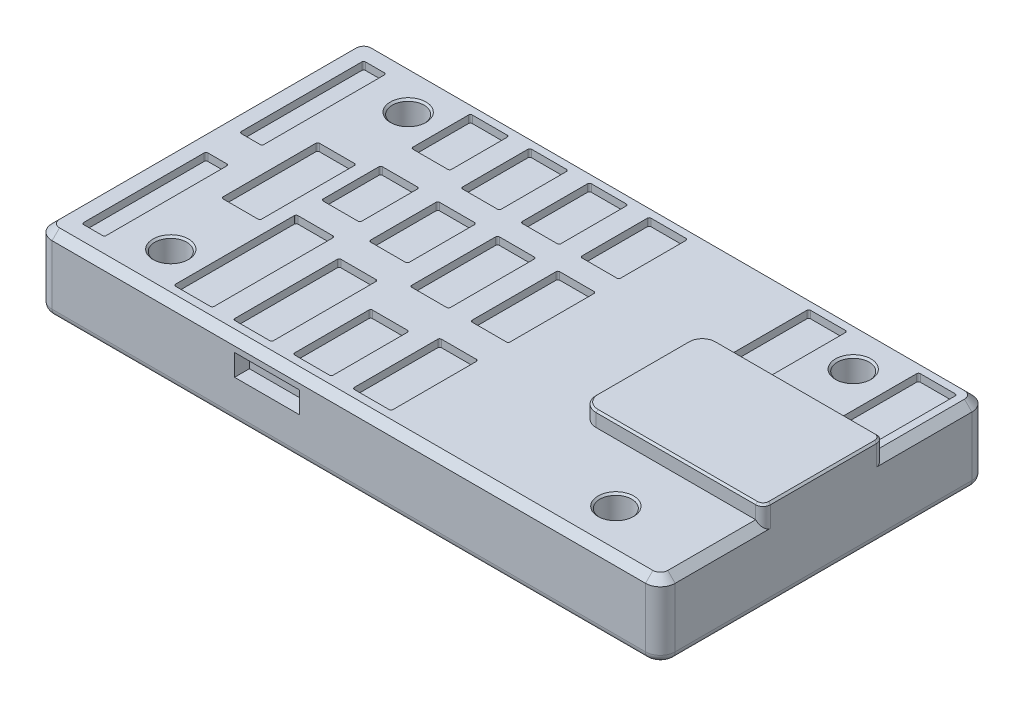
from build123d import *

# Parameters (mm, degrees)
SKETCH1_W               = 84
SKETCH1_H               = 44
BOSS_EXTRUDE1_DEPTH     = 10
SKETCH2_W               = 24.5
SKETCH2_H               = 16.3
BOSS_EXTRUDE2_DEPTH     = 2
FILLET1_R               = 2
FILLET2_R               = 2
FILLET3_R               = 1
FILLET4_R               = 1
CHAMFER1_SIZE           = 1
SKETCH3_R               = 0.875
CUT_EXTRUDE1_DEPTH      = 49.908077043
SKETCH4_R               = 2.15
CUT_EXTRUDE2_DEPTH      = 5
MIRROR3_COPY_1_SKETCH_R = 0.875
MIRROR3_COPY_1_DEPTH    = 49.908077043
MIRROR3_COPY_2_SKETCH_R = 2.15
MIRROR3_COPY_2_DEPTH    = 5
CHAMFER4_SIZE           = 0.25
CUT_EXTRUDE3_DEPTH      = 1
CUT_EXTRUDE4_DEPTH      = 1
CUT_EXTRUDE5_DEPTH      = 1
CUT_EXTRUDE6_DEPTH      = 1
SKETCH9_W               = 14
SKETCH9_H               = 2.3
CUT_EXTRUDE7_DEPTH      = 5
SKETCH10_W              = 8.75
SKETCH10_H              = 2.9
CUT_EXTRUDE8_DEPTH      = 2


with BuildPart() as part:
    # Sketch1 → Boss-Extrude1 (new body)
    with BuildSketch(Plane(origin=(0, 0, 0), x_dir=(1, 0, 0), z_dir=(0, 1, 0))):
        Rectangle(SKETCH1_W, SKETCH1_H)
    extrude(amount=BOSS_EXTRUDE1_DEPTH)

    # Sketch2 → Boss-Extrude2 (add)
    with BuildSketch(Plane(origin=(0, 10, 0), x_dir=(1, 0, 0), z_dir=(0, 1, 0))):
        with Locations((29.75, 0)):
            Rectangle(SKETCH2_W, SKETCH2_H)
    extrude(amount=BOSS_EXTRUDE2_DEPTH)

    # Fillet1
    fillet1_edges = [part.edges().sort_by_distance(p)[0] for p in [
        (17.5, 11, -8.15),
        (17.5, 11, 8.15),
    ]]
    fillet(fillet1_edges, radius=FILLET1_R)

    # Fillet2
    fillet2_edges = [part.edges().sort_by_distance(p)[0] for p in [
        (42, 5, 22),
        (-42, 5, 22),
        (-42, 5, -22),
        (42, 5, -22),
    ]]
    fillet(fillet2_edges, radius=FILLET2_R)

    # Fillet3
    fillet3_edges = [part.edges().sort_by_distance(p)[0] for p in [
        (-42, 0, 0),
        (42, 0, 0),
        (0, 0, 22),
        (0, 0, -22),
        (41.414213562, 0, 21.414213562),
        (41.414213562, 0, -21.414213562),
        (-41.414213562, 0, 21.414213562),
        (-41.414213562, 0, -21.414213562),
    ]]
    fillet(fillet3_edges, radius=FILLET3_R)

    # Fillet4
    fillet4_edges = [part.edges().sort_by_distance(p)[0] for p in [
        (42, 11, 8.15),
        (42, 11, -8.15),
    ]]
    fillet(fillet4_edges, radius=FILLET4_R)

    # Chamfer1
    chamfer1_edges = [part.edges().sort_by_distance(p)[0] for p in [
        (42, 10, 13.575),
        (41.414213562, 10, 21.414213562),
        (0, 10, 22),
        (-41.414213562, 10, 21.414213562),
        (42, 10, -13.575),
        (-42, 10, 0),
        (41.414213562, 10, -21.414213562),
        (-41.414213562, 10, -21.414213562),
        (0, 10, -22),
    ]]
    chamfer(chamfer1_edges, length=CHAMFER1_SIZE)

    # Sketch3 → Cut-Extrude1 (cut, through all)
    with BuildSketch(Plane.XZ):
        with Locations(Location((30, 16, 0), (0, 0, 270))):
            Circle(SKETCH3_R)
    cut_extrude1 = extrude(amount=-CUT_EXTRUDE1_DEPTH, mode=Mode.SUBTRACT)

    # Sketch4 → Cut-Extrude2 (cut)
    with BuildSketch(Plane(origin=(0, 10, 0), x_dir=(1, 0, 0), z_dir=(0, 1, 0))):
        with Locations(Location((30, -16, 0), (0, 0, 270))):
            Circle(SKETCH4_R)
    cut_extrude2 = extrude(amount=-CUT_EXTRUDE2_DEPTH, mode=Mode.SUBTRACT)

    # Mirror2: Cut-Extrude1, Cut-Extrude2 across plane
    add(cut_extrude1.mirror(Plane.XY), mode=Mode.SUBTRACT)
    add(cut_extrude2.mirror(Plane.XY), mode=Mode.SUBTRACT)

    # Mirror3: Cut-Extrude1, Cut-Extrude2 across plane
    add(cut_extrude1.mirror(Plane(origin=(0, 0, 0), x_dir=(0, 0, 1), z_dir=(1, 0, 0))), mode=Mode.SUBTRACT)
    add(cut_extrude2.mirror(Plane(origin=(0, 0, 0), x_dir=(0, 0, 1), z_dir=(1, 0, 0))), mode=Mode.SUBTRACT)

    # Mirror3 copy 1 sketch → Mirror3 copy 1 (cut, through all)
    with BuildSketch(Plane(origin=(0, 0, 0), x_dir=(-1, 0, 0), z_dir=(0, -1, 0))):
        with Locations(Location((30, 16, 0), (0, 0, 270))):
            Circle(MIRROR3_COPY_1_SKETCH_R)
    extrude(amount=-MIRROR3_COPY_1_DEPTH, mode=Mode.SUBTRACT)

    # Mirror3 copy 2 sketch → Mirror3 copy 2 (cut)
    with BuildSketch(Plane(origin=(0, 10, 0), x_dir=(-1, 0, 0), z_dir=(0, 1, 0))):
        with Locations(Location((30, -16, 0), (0, 0, 270))):
            Circle(MIRROR3_COPY_2_SKETCH_R)
    extrude(amount=-MIRROR3_COPY_2_DEPTH, mode=Mode.SUBTRACT)

    # Chamfer4
    chamfer4_edges = [part.edges().sort_by_distance(p)[0] for p in [
        (30, 10, 13.85),
        (30, 10, -13.85),
        (-30, 10, -13.85),
        (-30, 10, 13.85),
        (17.5, 12, 0),
        (30.25, 12, 8.15),
        (18.085786438, 12, 7.564213562),
        (18.085786438, 12, -7.564213562),
        (30.25, 12, -8.15),
        (42, 12, 0),
        (41.707106781, 12, 7.857106781),
        (41.707106781, 12, -7.857106781),
    ]]
    chamfer(chamfer4_edges, length=CHAMFER4_SIZE)

    # Sketch5 → Cut-Extrude3 (cut)
    with BuildSketch(Plane(origin=(0, 10, 0), x_dir=(1, 0, 0), z_dir=(0, 1, 0))):
        with BuildLine():
            Line((39.75, 20), (35.05, 20))
            ThreePointArc((35.05, 20), (34.873223305, 19.926776695), (34.8, 19.75))
            Line((34.8, 19.75), (34.8, 8.5))
            ThreePointArc((34.8, 8.5), (34.873223305, 8.323223305), (35.05, 8.25))
            Line((35.05, 8.25), (39.75, 8.25))
            ThreePointArc((39.75, 8.25), (39.926776695, 8.323223305), (40, 8.5))
            Line((40, 8.5), (40, 19.75))
            ThreePointArc((40, 19.75), (39.926776695, 19.926776695), (39.75, 20))
        make_face()
        with BuildLine():
            Line((24.95, 20), (20.25, 20))
            ThreePointArc((20.25, 20), (20.073223305, 19.926776695), (20, 19.75))
            Line((20, 19.75), (20, 8.5))
            ThreePointArc((20, 8.5), (20.073223305, 8.323223305), (20.25, 8.25))
            Line((20.25, 8.25), (24.95, 8.25))
            ThreePointArc((24.95, 8.25), (25.126776695, 8.323223305), (25.2, 8.5))
            Line((25.2, 8.5), (25.2, 19.75))
            ThreePointArc((25.2, 19.75), (25.126776695, 19.926776695), (24.95, 20))
        make_face()
        with BuildLine():
            Line((3.444382543, 20), (-1.255617457, 20))
            ThreePointArc((-1.255617457, 20), (-1.432394152, 19.926776695), (-1.505617457, 19.75))
            Line((-1.505617457, 19.75), (-1.505617457, 10.95))
            ThreePointArc((-1.505617457, 10.95), (-1.432394152, 10.773223305), (-1.255617457, 10.7))
            Line((-1.255617457, 10.7), (3.444382543, 10.7))
            ThreePointArc((3.444382543, 10.7), (3.621159238, 10.773223305), (3.694382543, 10.95))
            Line((3.694382543, 10.95), (3.694382543, 19.75))
            ThreePointArc((3.694382543, 19.75), (3.621159238, 19.926776695), (3.444382543, 20))
        make_face()
        with BuildLine():
            Line((-4.605617457, 20), (-9.305617457, 20))
            ThreePointArc((-9.305617457, 20), (-9.482394152, 19.926776695), (-9.555617457, 19.75))
            Line((-9.555617457, 19.75), (-9.555617457, 10.95))
            ThreePointArc((-9.555617457, 10.95), (-9.482394152, 10.773223305), (-9.305617457, 10.7))
            Line((-9.305617457, 10.7), (-4.605617457, 10.7))
            ThreePointArc((-4.605617457, 10.7), (-4.428840762, 10.773223305), (-4.355617457, 10.95))
            Line((-4.355617457, 10.95), (-4.355617457, 19.75))
            ThreePointArc((-4.355617457, 19.75), (-4.428840762, 19.926776695), (-4.605617457, 20))
        make_face()
        with BuildLine():
            Line((-12.655617457, 20), (-17.355617457, 20))
            ThreePointArc((-17.355617457, 20), (-17.532394152, 19.926776695), (-17.605617457, 19.75))
            Line((-17.605617457, 19.75), (-17.605617457, 10.95))
            ThreePointArc((-17.605617457, 10.95), (-17.532394152, 10.773223305), (-17.355617457, 10.7))
            Line((-17.355617457, 10.7), (-12.655617457, 10.7))
            ThreePointArc((-12.655617457, 10.7), (-12.478840762, 10.773223305), (-12.405617457, 10.95))
            Line((-12.405617457, 10.95), (-12.405617457, 19.75))
            ThreePointArc((-12.405617457, 19.75), (-12.478840762, 19.926776695), (-12.655617457, 20))
        make_face()
    extrude(amount=-CUT_EXTRUDE3_DEPTH, mode=Mode.SUBTRACT)

    # Sketch6 → Cut-Extrude4 (cut)
    with BuildSketch(Plane(origin=(0, 10, 0), x_dir=(1, 0, 0), z_dir=(0, 1, 0))):
        with BuildLine():
            Line((3.444382543, -20), (-1.255617457, -20))
            ThreePointArc((-1.255617457, -20), (-1.432394152, -19.926776695), (-1.505617457, -19.75))
            Line((-1.505617457, -19.75), (-1.505617457, -8.5))
            ThreePointArc((-1.505617457, -8.5), (-1.432394152, -8.323223305), (-1.255617457, -8.25))
            Line((-1.255617457, -8.25), (3.444382543, -8.25))
            ThreePointArc((3.444382543, -8.25), (3.621159238, -8.323223305), (3.694382543, -8.5))
            Line((3.694382543, -8.5), (3.694382543, -19.75))
            ThreePointArc((3.694382543, -19.75), (3.621159238, -19.926776695), (3.444382543, -20))
        make_face()
        with BuildLine():
            Line((-4.605617457, -20), (-9.305617457, -20))
            ThreePointArc((-9.305617457, -20), (-9.482394152, -19.926776695), (-9.555617457, -19.75))
            Line((-9.555617457, -19.75), (-9.555617457, -9.75))
            ThreePointArc((-9.555617457, -9.75), (-9.482394152, -9.573223305), (-9.305617457, -9.5))
            Line((-9.305617457, -9.5), (-4.605617457, -9.5))
            ThreePointArc((-4.605617457, -9.5), (-4.428840762, -9.573223305), (-4.355617457, -9.75))
            Line((-4.355617457, -9.75), (-4.355617457, -19.75))
            ThreePointArc((-4.355617457, -19.75), (-4.428840762, -19.926776695), (-4.605617457, -20))
        make_face()
        with BuildLine():
            Line((-12.655617457, -20), (-17.355617457, -20))
            ThreePointArc((-17.355617457, -20), (-17.532394152, -19.926776695), (-17.605617457, -19.75))
            Line((-17.605617457, -19.75), (-17.605617457, -5.95))
            ThreePointArc((-17.605617457, -5.95), (-17.532394152, -5.773223305), (-17.355617457, -5.7))
            Line((-17.355617457, -5.7), (-12.655617457, -5.7))
            ThreePointArc((-12.655617457, -5.7), (-12.478840762, -5.773223305), (-12.405617457, -5.95))
            Line((-12.405617457, -5.95), (-12.405617457, -19.75))
            ThreePointArc((-12.405617457, -19.75), (-12.478840762, -19.926776695), (-12.655617457, -20))
        make_face()
        with BuildLine():
            Line((-20.655617457, -20), (-25.355617457, -20))
            ThreePointArc((-25.355617457, -20), (-25.532394152, -19.926776695), (-25.605617457, -19.75))
            Line((-25.605617457, -19.75), (-25.605617457, -3.75))
            ThreePointArc((-25.605617457, -3.75), (-25.532394152, -3.573223305), (-25.355617457, -3.5))
            Line((-25.355617457, -3.5), (-20.655617457, -3.5))
            ThreePointArc((-20.655617457, -3.5), (-20.478840762, -3.573223305), (-20.405617457, -3.75))
            Line((-20.405617457, -3.75), (-20.405617457, -19.75))
            ThreePointArc((-20.405617457, -19.75), (-20.478840762, -19.926776695), (-20.655617457, -20))
        make_face()
        with BuildLine():
            Line((-20.655617457, -0.1), (-25.355617457, -0.1))
            ThreePointArc((-25.355617457, -0.1), (-25.532394152, -0.026776695), (-25.605617457, 0.15))
            Line((-25.605617457, 0.15), (-25.605617457, 7.65))
            ThreePointArc((-25.605617457, 7.65), (-25.532394152, 7.826776695), (-25.355617457, 7.9))
            Line((-25.355617457, 7.9), (-20.655617457, 7.9))
            ThreePointArc((-20.655617457, 7.9), (-20.478840762, 7.826776695), (-20.405617457, 7.65))
            Line((-20.405617457, 7.65), (-20.405617457, 0.15))
            ThreePointArc((-20.405617457, 0.15), (-20.478840762, -0.026776695), (-20.655617457, -0.1))
        make_face()
        with BuildLine():
            Line((-20.655617457, 20), (-25.355617457, 20))
            ThreePointArc((-25.355617457, 20), (-25.532394152, 19.926776695), (-25.605617457, 19.75))
            Line((-25.605617457, 19.75), (-25.605617457, 12.25))
            ThreePointArc((-25.605617457, 12.25), (-25.532394152, 12.073223305), (-25.355617457, 12))
            Line((-25.355617457, 12), (-20.655617457, 12))
            ThreePointArc((-20.655617457, 12), (-20.478840762, 12.073223305), (-20.405617457, 12.25))
            Line((-20.405617457, 12.25), (-20.405617457, 19.75))
            ThreePointArc((-20.405617457, 19.75), (-20.478840762, 19.926776695), (-20.655617457, 20))
        make_face()
    extrude(amount=-CUT_EXTRUDE4_DEPTH, mode=Mode.SUBTRACT)

    # Sketch7 → Cut-Extrude5 (cut)
    with BuildSketch(Plane(origin=(0, 10, 0), x_dir=(1, 0, 0), z_dir=(0, 1, 0))):
        with BuildLine():
            Line((3.444382543, 7.6), (-1.164029398, 7.6))
            ThreePointArc((-1.164029398, 7.6), (-1.340806093, 7.526776695), (-1.414029398, 7.35))
            Line((-1.414029398, 7.35), (-1.414029398, -3.95))
            ThreePointArc((-1.414029398, -3.95), (-1.340806093, -4.126776695), (-1.164029398, -4.2))
            Line((-1.164029398, -4.2), (3.444382543, -4.2))
            ThreePointArc((3.444382543, -4.2), (3.621159238, -4.126776695), (3.694382543, -3.95))
            Line((3.694382543, -3.95), (3.694382543, 7.35))
            ThreePointArc((3.694382543, 7.35), (3.621159238, 7.526776695), (3.444382543, 7.6))
        make_face()
        with BuildLine():
            Line((-4.605617457, 7.6), (-9.305617457, 7.6))
            ThreePointArc((-9.305617457, 7.6), (-9.482394152, 7.526776695), (-9.555617457, 7.35))
            Line((-9.555617457, 7.35), (-9.555617457, -3.95))
            ThreePointArc((-9.555617457, -3.95), (-9.482394152, -4.126776695), (-9.305617457, -4.2))
            Line((-9.305617457, -4.2), (-4.605617457, -4.2))
            ThreePointArc((-4.605617457, -4.2), (-4.428840762, -4.126776695), (-4.355617457, -3.95))
            Line((-4.355617457, -3.95), (-4.355617457, 7.35))
            ThreePointArc((-4.355617457, 7.35), (-4.428840762, 7.526776695), (-4.605617457, 7.6))
        make_face()
        with BuildLine():
            Line((-12.655617457, 7.6), (-17.355617457, 7.6))
            ThreePointArc((-17.355617457, 7.6), (-17.532394152, 7.526776695), (-17.605617457, 7.35))
            Line((-17.605617457, 7.35), (-17.605617457, -1.45))
            ThreePointArc((-17.605617457, -1.45), (-17.532394152, -1.626776695), (-17.355617457, -1.7))
            Line((-17.355617457, -1.7), (-12.655617457, -1.7))
            ThreePointArc((-12.655617457, -1.7), (-12.478840762, -1.626776695), (-12.405617457, -1.45))
            Line((-12.405617457, -1.45), (-12.405617457, 7.35))
            ThreePointArc((-12.405617457, 7.35), (-12.478840762, 7.526776695), (-12.655617457, 7.6))
        make_face()
    extrude(amount=-CUT_EXTRUDE5_DEPTH, mode=Mode.SUBTRACT)

    # Sketch8 → Cut-Extrude6 (cut)
    with BuildSketch(Plane(origin=(0, 10, 0), x_dir=(1, 0, 0), z_dir=(0, 1, 0))):
        with BuildLine():
            Line((-27.65, 6.401196142), (-32.35, 6.401196142))
            ThreePointArc((-32.35, 6.401196142), (-32.526776695, 6.327972838), (-32.6, 6.151196142))
            Line((-32.6, 6.151196142), (-32.6, -6.348803858))
            ThreePointArc((-32.6, -6.348803858), (-32.526776695, -6.525580553), (-32.35, -6.598803858))
            Line((-32.35, -6.598803858), (-27.65, -6.598803858))
            ThreePointArc((-27.65, -6.598803858), (-27.473223305, -6.525580553), (-27.4, -6.348803858))
            Line((-27.4, -6.348803858), (-27.4, 6.151196142))
            ThreePointArc((-27.4, 6.151196142), (-27.473223305, 6.327972838), (-27.65, 6.401196142))
        make_face()
        with BuildLine():
            Line((-38.75, 19), (-36.20439822, 19))
            ThreePointArc((-36.20439822, 19), (-36.027621524, 18.926776695), (-35.95439822, 18.75))
            Line((-35.95439822, 18.75), (-35.95439822, 2.5))
            ThreePointArc((-35.95439822, 2.5), (-36.027621524, 2.323223305), (-36.20439822, 2.25))
            Line((-36.20439822, 2.25), (-38.75, 2.25))
            ThreePointArc((-38.75, 2.25), (-38.926776695, 2.323223305), (-39, 2.5))
            Line((-39, 2.5), (-39, 18.75))
            ThreePointArc((-39, 18.75), (-38.926776695, 18.926776695), (-38.75, 19))
        make_face()
        with BuildLine():
            Line((-36.20439822, -2.25), (-38.75, -2.25))
            ThreePointArc((-38.75, -2.25), (-38.926776695, -2.323223305), (-39, -2.5))
            Line((-39, -2.5), (-39, -18.75))
            ThreePointArc((-39, -18.75), (-38.926776695, -18.926776695), (-38.75, -19))
            Line((-38.75, -19), (-36.20439822, -19))
            ThreePointArc((-36.20439822, -19), (-36.027621524, -18.926776695), (-35.95439822, -18.75))
            Line((-35.95439822, -18.75), (-35.95439822, -2.5))
            ThreePointArc((-35.95439822, -2.5), (-36.027621524, -2.323223305), (-36.20439822, -2.25))
        make_face()
    extrude(amount=-CUT_EXTRUDE6_DEPTH, mode=Mode.SUBTRACT)

    # Sketch9 → Cut-Extrude7 (cut)
    with BuildSketch(Plane.ZY.offset(42)):
        with Locations((-1.5, 3.25)):
            Rectangle(SKETCH9_W, SKETCH9_H)
    extrude(amount=-CUT_EXTRUDE7_DEPTH, mode=Mode.SUBTRACT)

    # Sketch10 → Cut-Extrude8 (cut)
    with BuildSketch(Plane.XY.offset(22)):
        with Locations((-11.025, 6.8)):
            Rectangle(SKETCH10_W, SKETCH10_H)
    extrude(amount=-CUT_EXTRUDE8_DEPTH, mode=Mode.SUBTRACT)


solid = part.part
